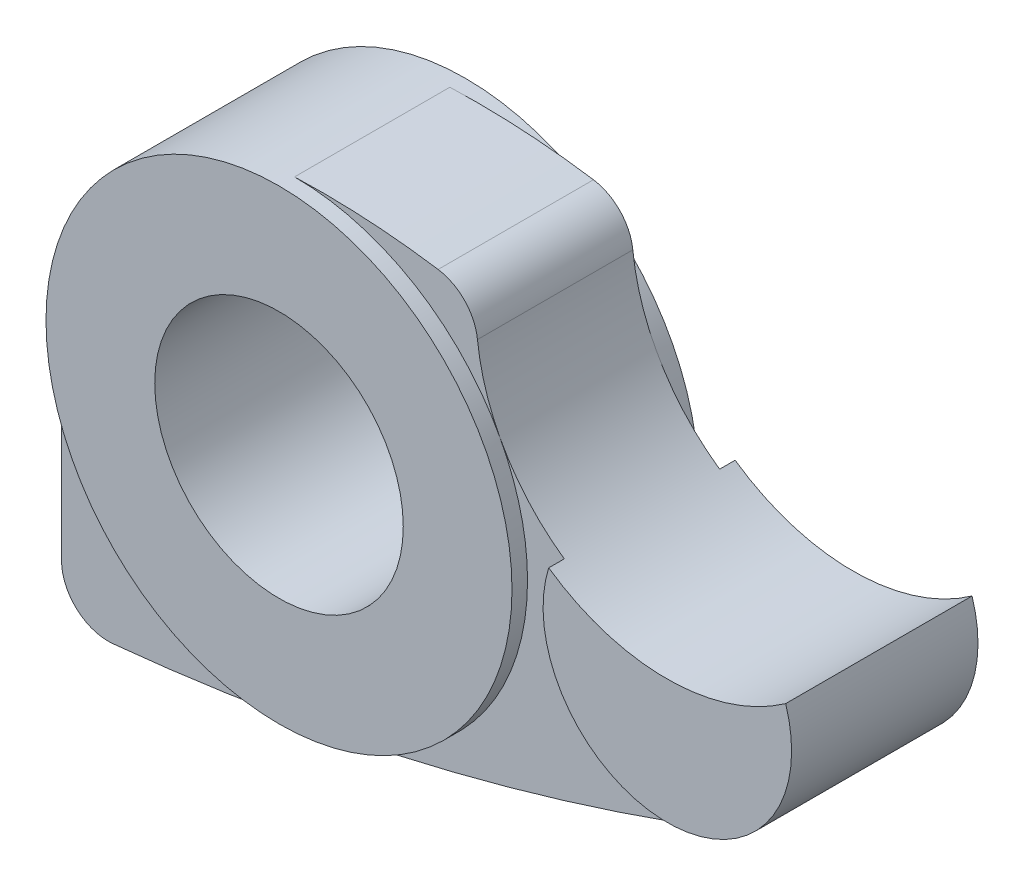
from build123d import *

# Parameters (mm, degrees)
SKETCH_1_R      = 15
SKETCH_1_R_2    = 8
EXTRUDE_1_DEPTH = 6
EXTRUDE_3_DEPTH = 6
EXTRUDE_4_DEPTH = 5


with BuildPart() as part:
    # 草图1 → 凸台-拉伸1 (new, symmetric)
    with BuildSketch(Plane.XY):
        Circle(SKETCH_1_R)
        Circle(SKETCH_1_R_2, mode=Mode.SUBTRACT)
    extrude(amount=EXTRUDE_1_DEPTH, both=True)



with BuildPart() as body_2:
    # 草图2 → 凸台-拉伸3 (new, symmetric)
    with BuildSketch(Plane.XY):
        with BuildLine():
            ThreePointArc((17.364190492, 2.386296955), (19.534557037, -5.841997366), (27.889014085, -7.460133888))
            ThreePointArc((27.889014085, -7.460133888), (32.219376902, -3.446824212), (32.617582381, 2.443857334))
            ThreePointArc((32.617582381, 2.443857334), (25, 0), (17.364190492, 2.386296955))
        make_face()
    extrude(amount=EXTRUDE_3_DEPTH, both=True)


with BuildPart() as part_1:
    add(part.part)

    add(body_2.part)  # 凸台-拉伸4 merges body 2
    # 草图2<4> → 凸台-拉伸4 (add, symmetric)
    with BuildSketch(Plane.XY):
        with BuildLine():
            ThreePointArc((2.920001822, -14.713041472), (-9.51840251, -11.593101986), (-15, 0))
            Line((-15, 0), (-15, -13.8873794))
            ThreePointArc((-15, -13.8873794), (-14.015653031, -16.10934764), (-11.708571429, -16.873190745))
            ThreePointArc((-11.708571429, -16.873190745), (-4.367649809, -15.973488812), (2.920001822, -14.713041472))
        make_face()
        with BuildLine():
            ThreePointArc((9.245195089, 14.463447909), (4.635046482, 14.946228489), (0, 15))
            ThreePointArc((0, 15), (7.728834811, 12.855547926), (13.247787509, 7.035348329))
            ThreePointArc((13.247787509, 7.035348329), (12.284448117, 9.358081475), (11.777275068, 11.820983737))
            ThreePointArc((11.777275068, 11.820983737), (10.960851201, 13.57305004), (9.245195089, 14.463447909))
        make_face()
        with BuildLine():
            ThreePointArc((13.247787509, 7.035348329), (13.549814305, -6.434479956), (2.920001822, -14.713041472))
            ThreePointArc((2.920001822, -14.713041472), (15.561957057, -11.62862528), (27.889014085, -7.460133888))
            ThreePointArc((27.889014085, -7.460133888), (19.534557037, -5.841997366), (17.364190492, 2.386296955))
            ThreePointArc((17.364190492, 2.386296955), (15.029800011, 4.466277015), (13.247787509, 7.035348329))
        make_face()
    extrude(amount=EXTRUDE_4_DEPTH, both=True)


solid = part_1.part
